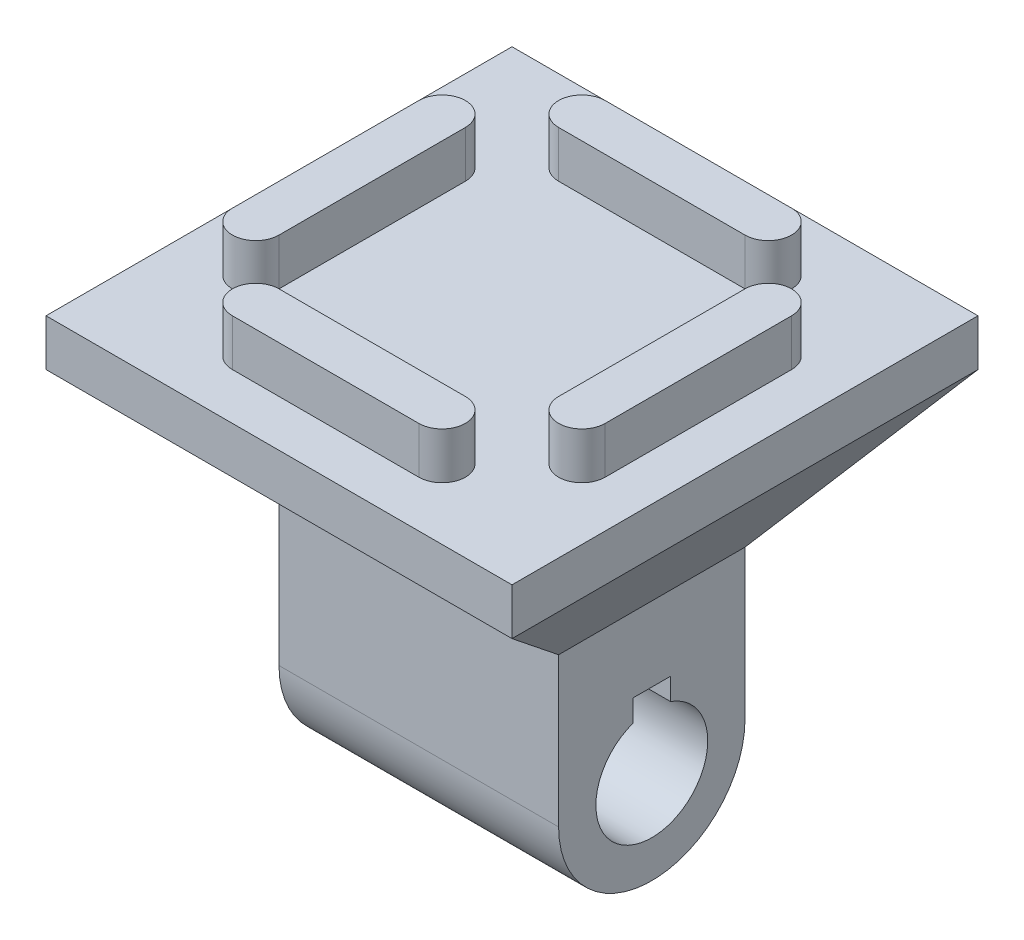
from build123d import *

# Parameters (mm, degrees)
SKETCH1_W                = 50
SKETCH1_H                = 50
BOSS_EXTRUDE1_DEPTH      = 5
BOSS_EXTRUDE2_DEPTH      = 5
CIRPATTERN1_COUNT        = 4
SKETCH3_R                = 10
SKETCH3_R_2              = 6
BOSS_EXTRUDE3_DEPTH      = 15
BOSS_EXTRUDE4_REACH      = 45.886
BOSS_EXTRUDE4_END_RADIUS = 10
SKETCH4_W                = 30
SKETCH4_H                = 20
SKETCH5_W                = 4
SKETCH5_H                = 4
CUT_EXTRUDE2_DEPTH       = 30


with BuildPart() as part:
    # Sketch1 → Boss-Extrude1 (new body)
    with BuildSketch(Plane(origin=(0, 0, 0), x_dir=(1, 0, 0), z_dir=(0, 1, 0))):
        Rectangle(SKETCH1_W, SKETCH1_H)
    extrude(amount=BOSS_EXTRUDE1_DEPTH)

    # Sketch2 → Boss-Extrude2 (add)
    with BuildSketch(Plane(origin=(0, 5, 0), x_dir=(1, 0, 0), z_dir=(0, 1, 0))):
        with BuildLine():
            Line((-15, 10), (-15, -10))
            ThreePointArc((-15, -10), (-17.5, -12.5), (-20, -10))
            Line((-20, -10), (-20, 10))
            ThreePointArc((-20, 10), (-17.5, 12.5), (-15, 10))
        make_face()
    boss_extrude2 = extrude(amount=BOSS_EXTRUDE2_DEPTH)

    # CirPattern1: Boss-Extrude2 ×4 about axis
    cirpattern1_axis = Axis((0, 0, 0), (0, 1, 0))
    for i in range(1, CIRPATTERN1_COUNT):
        add(boss_extrude2.rotate(cirpattern1_axis, i * 360 / CIRPATTERN1_COUNT))


with BuildPart() as body_2:
    # Sketch3 → Boss-Extrude3 (new, symmetric)
    with BuildSketch(Plane(origin=(0, 0, 0), x_dir=(0, 0, -1), z_dir=(1, 0, 0))):
        with Locations((0, -30)):
            Circle(SKETCH3_R)
        with Locations((0, -30)):
            Circle(SKETCH3_R_2, mode=Mode.SUBTRACT)
    extrude(amount=BOSS_EXTRUDE3_DEPTH, both=True)

    # Boss-Extrude4: up to this cylinder (the profile starts outside it)
    boss_extrude4_end = Plane(origin=(0, -30, 0), z_dir=(-1, 0, 0)) * Cylinder(BOSS_EXTRUDE4_END_RADIUS, 112.772, mode=Mode.PRIVATE)
    # Sketch4 → Boss-Extrude4 (add, up to the surface)
    with BuildSketch(Plane(origin=(0, -14, 0), x_dir=(-1, 0, 0), z_dir=(0, -1, 0)), mode=Mode.PRIVATE) as boss_extrude4_sk1:
        Rectangle(SKETCH4_W, SKETCH4_H)
    boss_extrude4_tool1 = extrude(boss_extrude4_sk1.sketch, amount=BOSS_EXTRUDE4_REACH, mode=Mode.PRIVATE) - boss_extrude4_end
    add(boss_extrude4_tool1.solids().sort_by_distance((0, -14, 0))[0])


    add(part.part)  # loft1 joins it to this body
    # loft from a face of the part (loft1)
    loft([body_2.faces().sort_by_distance((0, -14, 0))[0], body_2.faces().sort_by_distance((0, 0, 0))[0]])

    # Sketch5 → Cut-Extrude2 (cut)
    with BuildSketch(Plane.ZY.offset(15)):
        with Locations((0, -24)):
            Rectangle(SKETCH5_W, SKETCH5_H)
    extrude(amount=-CUT_EXTRUDE2_DEPTH, mode=Mode.SUBTRACT)


solid = body_2.part
